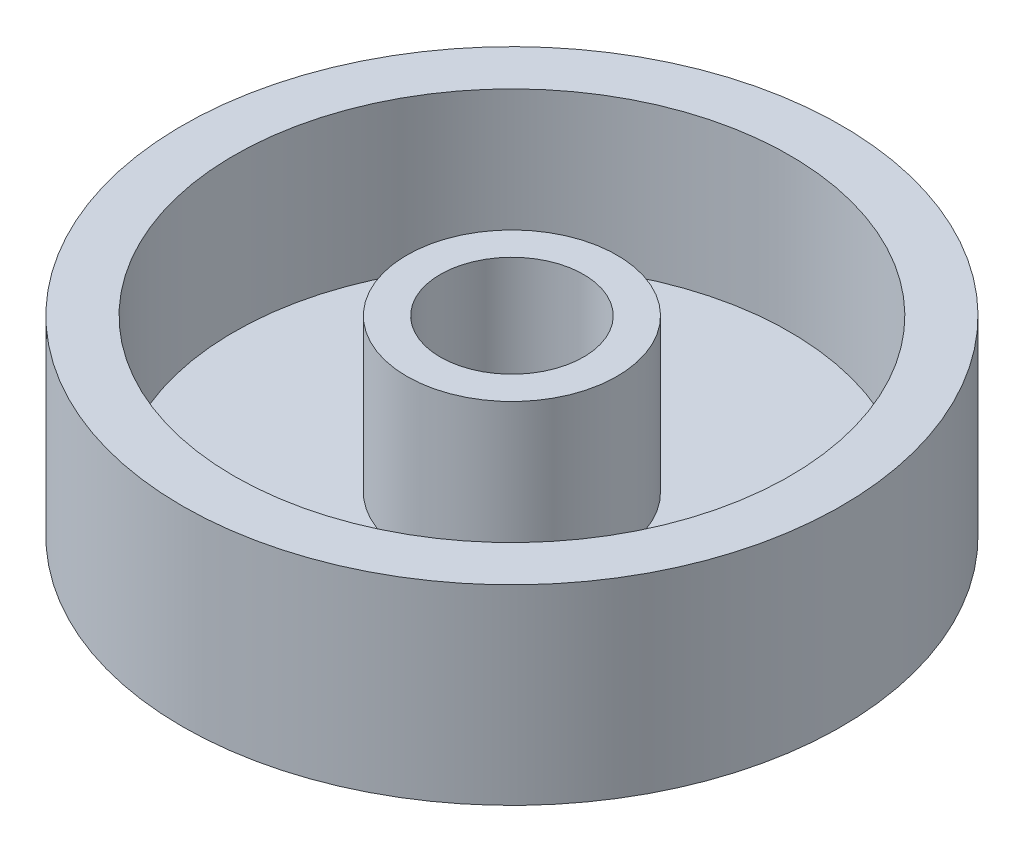
from build123d import *

# Parameters (mm, degrees)
SKETCH_1_R          = 6.9
EXTRUDE_1_DEPTH     = 4
SKETCH_2_R          = 5.817135152
SKETCH_2_R_2        = 2.2
CUT_EXTRUDE_2_DEPTH = 3.2
SKETCH_3_R          = 1.5
CUT_EXTRUDE_3_DEPTH = 11.546089323


with BuildPart() as part:
    # Эскиз1 → Вытянуть1 (new body)
    with BuildSketch(Plane(origin=(0, 0, 0), x_dir=(1, 0, 0), z_dir=(0, 1, 0))):
        with Locations(Location((0, 0, 0), (0, 0, 270))):
            Circle(SKETCH_1_R)
    extrude(amount=EXTRUDE_1_DEPTH)

    # Эскиз2 → Вытянуть2 (cut)
    with BuildSketch(Plane(origin=(0, 4, 0), x_dir=(1, 0, 0), z_dir=(0, 1, 0))):
        with Locations(Location((0, 0, 0), (0, 0, 270))):
            Circle(SKETCH_2_R)
        with Locations(Location((0, 0, 0), (0, 0, 270))):
            Circle(SKETCH_2_R_2, mode=Mode.SUBTRACT)
    extrude(amount=-CUT_EXTRUDE_2_DEPTH, mode=Mode.SUBTRACT)

    # Эскиз3 → Вытянуть3 (cut, through all)
    with BuildSketch(Plane(origin=(0, 4, 0), x_dir=(1, 0, 0), z_dir=(0, 1, 0))):
        with Locations(Location((0, 0, 0), (0, 0, 270))):
            Circle(SKETCH_3_R)
    extrude(amount=-CUT_EXTRUDE_3_DEPTH, mode=Mode.SUBTRACT)


solid = part.part
